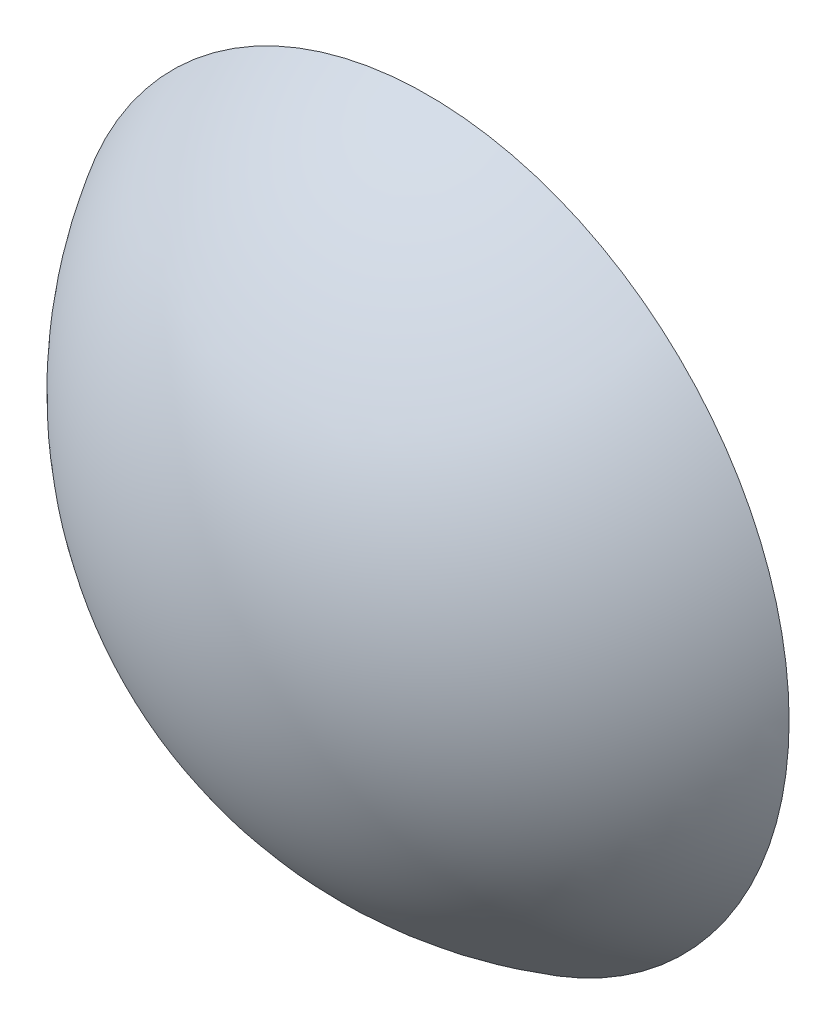
from build123d import *


with BuildPart() as part:
    # sketch:main-profile → feature:sphere-cap (revolve)
    with BuildSketch(Plane.XZ):
        with BuildLine():
            Line((0, 10), (0, 5))
            Line((0, 5), (8.660254038, 5))
            ThreePointArc((8.660254038, 5), (5, 8.660254038), (0, 10))
        make_face()
    revolve(axis=Axis((0, 0, -15), (0, 0, 1)))


solid = part.part
